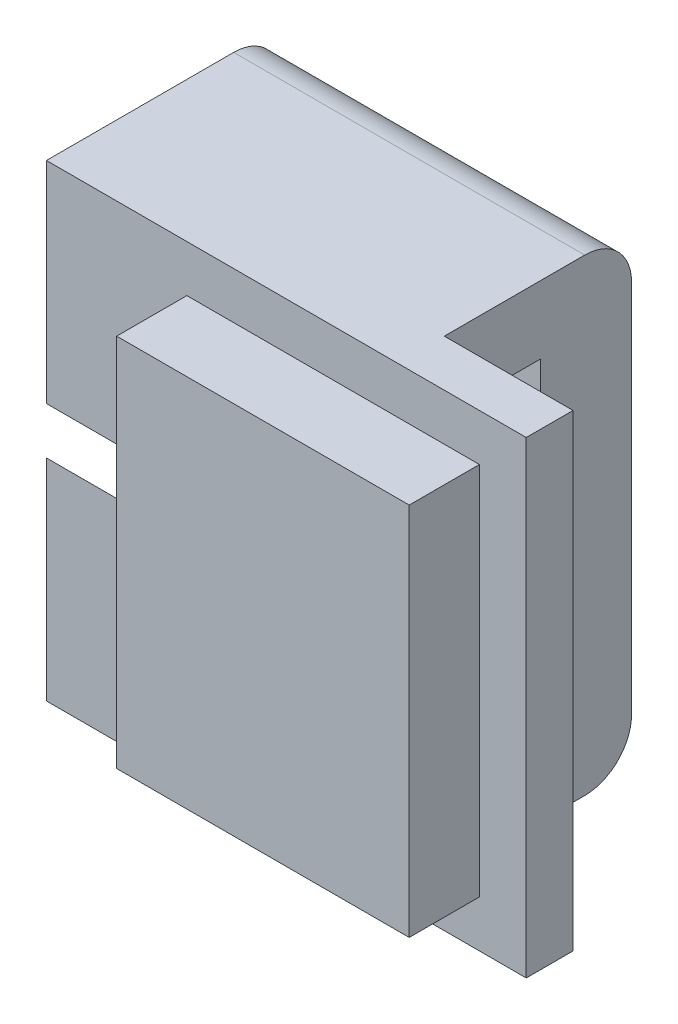
from build123d import *

# Parameters (mm, degrees)
SKETCH1_W           = 20
SKETCH1_H           = 10
BOSS_EXTRUDE1_DEPTH = 20.5
SKETCH5_W           = 16
SKETCH5_H           = 12.5
BOSS_EXTRUDE2_DEPTH = 8
SKETCH2_R           = 5.1
CUT_EXTRUDE3_DEPTH  = 10
SKETCH6_W           = 5.5
SKETCH6_H           = 20
CUT_EXTRUDE4_DEPTH  = 8
SKETCH7_W           = 2.2
SKETCH7_H           = 2.2
CUT_EXTRUDE5_DEPTH  = 3
FILLET1_R           = 2


with BuildPart() as part:
    # Sketch1 → Boss-Extrude1 (new body)
    with BuildSketch(Plane.YZ):
        Rectangle(SKETCH1_W, SKETCH1_H)
    extrude(amount=BOSS_EXTRUDE1_DEPTH)

    # Sketch5 → Boss-Extrude2 (add)
    with BuildSketch(Plane(origin=(0, 0, 0), x_dir=(0, 1, 0), z_dir=(0, 0, 1))):
        with Locations((0, -12.25)):
            Rectangle(SKETCH5_W, SKETCH5_H)
    extrude(amount=BOSS_EXTRUDE2_DEPTH)

    # Sketch2 → Cut-Extrude3 (cut)
    with BuildSketch(Plane.YZ):
        Circle(SKETCH2_R)
    extrude(amount=CUT_EXTRUDE3_DEPTH, mode=Mode.SUBTRACT)

    # Sketch6 → Cut-Extrude4 (cut)
    with BuildSketch(Plane(origin=(0, 0, -5), x_dir=(1, 0, 0), z_dir=(0, 0, -1))):
        with Locations((17.75, 0)):
            Rectangle(SKETCH6_W, SKETCH6_H)
    extrude(amount=-CUT_EXTRUDE4_DEPTH, mode=Mode.SUBTRACT)

    # Sketch7 → Cut-Extrude5 (cut)
    with BuildSketch(Plane.YZ.offset(15)):
        with Locations((6, 0)):
            Rectangle(SKETCH7_W, SKETCH7_H)
        with Locations((-6, 0)):
            Rectangle(SKETCH7_W, SKETCH7_H)
    extrude(amount=-CUT_EXTRUDE5_DEPTH, mode=Mode.SUBTRACT)

    # Fillet1
    fillet1_edges = [part.edges().sort_by_distance(p)[0] for p in [
        (7.5, -10, -5),
        (7.5, 10, -5),
    ]]
    fillet(fillet1_edges, radius=FILLET1_R)


solid = part.part
